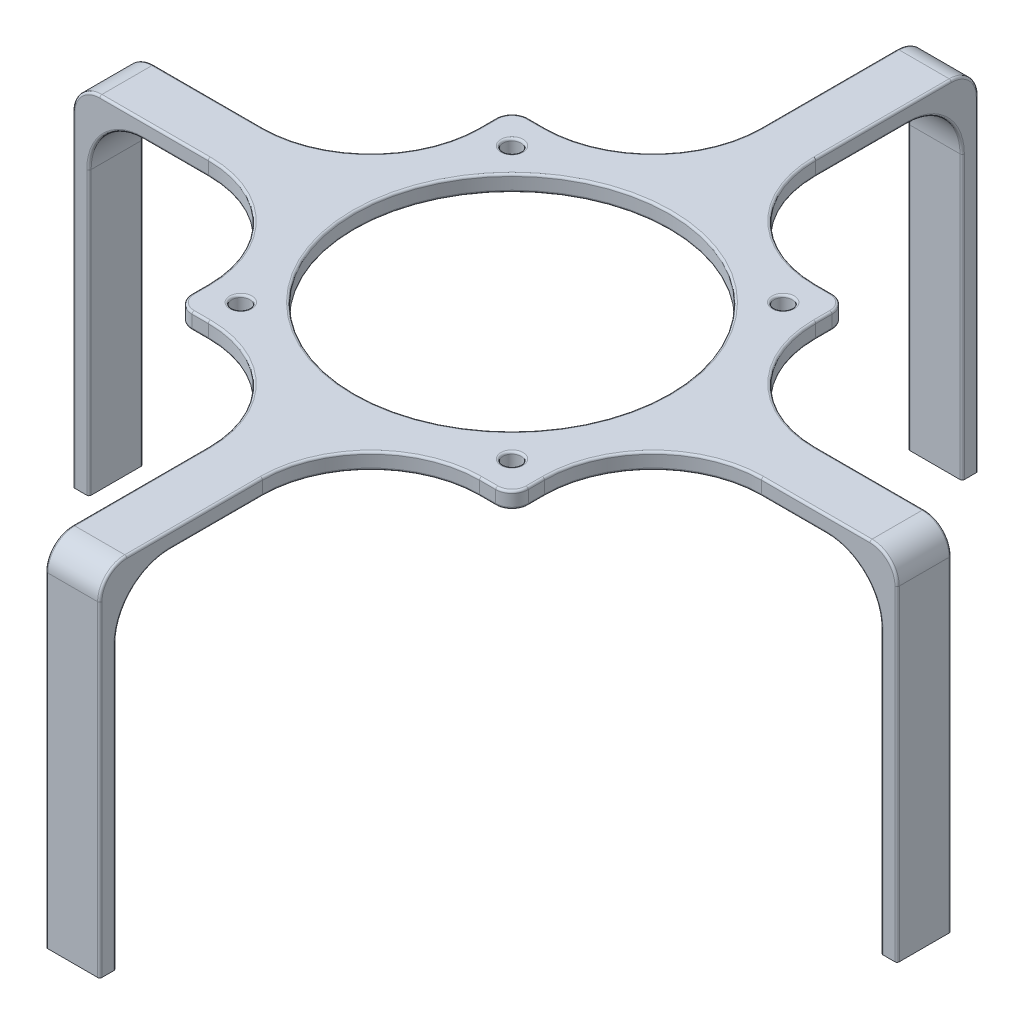
from build123d import *

# Parameters (mm, degrees)
SKETCH1_W           = 62
SKETCH1_H           = 62
BOSS_EXTRUDE1_DEPTH = 3
SKETCH2_R           = 1.65
SKETCH2_R_2         = 29
CUT_EXTRUDE1_DEPTH  = 10
SKETCH3_W           = 10
SKETCH3_H           = 50
SKETCH3_W_2         = 45
SKETCH3_H_2         = 10
BOSS_EXTRUDE2_DEPTH = 3
SKETCH4_W           = 10
SKETCH4_H           = 3
SKETCH4_W_2         = 3
SKETCH4_H_2         = 10
BOSS_EXTRUDE3_DEPTH = 62
FILLET2_R           = 10
FILLET3_R           = 5
FILLET1_R           = 20
FILLET4_R           = 3
FILLET5_R           = 0.4
FILLET7_R           = 0.4


with BuildPart() as part:
    # Sketch1 → Boss-Extrude1 (new body)
    with BuildSketch(Plane(origin=(0, 0, 0), x_dir=(1, 0, 0), z_dir=(0, 1, 0))):
        with Locations((31, -31)):
            Rectangle(SKETCH1_W, SKETCH1_H)
    extrude(amount=BOSS_EXTRUDE1_DEPTH)

    # Sketch2 → Cut-Extrude1 (cut)
    with BuildSketch(Plane(origin=(0, 0, 0), x_dir=(-1, 0, 0), z_dir=(0, -1, 0))):
        with Locations(Location((-56, -56, 0), (0, 0, 90))):
            Circle(SKETCH2_R)
        with Locations(Location((-6, -56, 0), (0, 0, 90))):
            Circle(SKETCH2_R)
        with Locations(Location((-6, -6, 0), (0, 0, 90))):
            Circle(SKETCH2_R)
        with Locations(Location((-56, -6, 0), (0, 0, 90))):
            Circle(SKETCH2_R)
        with Locations(Location((-31, -31, 0), (0, 0, 90))):
            Circle(SKETCH2_R_2)
    extrude(amount=-CUT_EXTRUDE1_DEPTH, mode=Mode.SUBTRACT)

    # Sketch3 → Boss-Extrude2 (add)
    with BuildSketch(Plane(origin=(0, 3, 0), x_dir=(1, 0, 0), z_dir=(0, 1, 0))):
        with Locations((31, 25)):
            Rectangle(SKETCH3_W, SKETCH3_H)
        with Locations((-22.5, -31)):
            Rectangle(SKETCH3_W_2, SKETCH3_H_2)
        with Locations((84.5, -31)):
            Rectangle(SKETCH3_W_2, SKETCH3_H_2)
        with Locations((31, -87)):
            Rectangle(SKETCH3_W, SKETCH3_H)
    extrude(amount=-BOSS_EXTRUDE2_DEPTH)

    # Sketch4 → Boss-Extrude3 (add)
    with BuildSketch(Plane(origin=(0, 0, 0), x_dir=(-1, 0, 0), z_dir=(0, -1, 0))):
        with Locations((-31, 48.5)):
            Rectangle(SKETCH4_W, SKETCH4_H)
        with Locations((-105.5, -31)):
            Rectangle(SKETCH4_W_2, SKETCH4_H_2)
        with Locations((-31, -110.5)):
            Rectangle(SKETCH4_W, SKETCH4_H)
        with Locations((43.5, -31)):
            Rectangle(SKETCH4_W_2, SKETCH4_H_2)
    extrude(amount=BOSS_EXTRUDE3_DEPTH)

    # Fillet2
    fillet2_edges = [part.edges().sort_by_distance(p)[0] for p in [
        (104, 0, 31),
        (31, 0, 109),
        (-42, 0, 31),
        (31, 0, -47),
    ]]
    fillet(fillet2_edges, radius=FILLET2_R)

    # Fillet3
    fillet3_edges = [part.edges().sort_by_distance(p)[0] for p in [
        (31, 3, -50),
        (-45, 3, 31),
        (107, 3, 31),
        (31, 3, 112),
    ]]
    fillet(fillet3_edges, radius=FILLET3_R)

    # Fillet1
    fillet1_edges = [part.edges().sort_by_distance(p)[0] for p in [
        (26, 1.5, 0),
        (36, 1.5, 0),
        (0, 1.5, 26),
        (0, 1.5, 36),
        (62, 1.5, 36),
        (62, 1.5, 26),
        (26, 1.5, 62),
        (36, 1.5, 62),
    ]]
    fillet(fillet1_edges, radius=FILLET1_R)

    # Fillet4
    fillet4_edges = [part.edges().sort_by_distance(p)[0] for p in [
        (0, 1.5, 0),
        (62, 1.5, 0),
        (62, 1.5, 62),
        (0, 1.5, 62),
    ]]
    fillet(fillet4_edges, radius=FILLET4_R)

    # Fillet5
    fillet5_edges = [part.edges().sort_by_distance(p)[0] for p in [
        (-30, 3, 36),
        (36, 3, 94.5),
        (92, 3, 26),
        (26, 3, -32.5),
        (105.535533906, 1.535533906, 26),
        (105.535533906, 1.535533906, 36),
        (36, 1.535533906, 110.535533906),
        (26, 1.535533906, 110.535533906),
        (-43.535533906, 1.535533906, 36),
        (-43.535533906, 1.535533906, 26),
        (26, 1.535533906, -48.535533906),
        (36, 1.535533906, -48.535533906),
        (6, 3, 57.65),
        (36, 3, -32.5),
        (4.5, 3, 0),
        (-30, 3, 26),
        (0, 3, 57.5),
        (26, 3, 94.5),
        (57.5, 3, 62),
        (62, 3, 4.5),
        (92, 3, 36),
        (41.857864376, 3, -5.857864376),
        (20.142135624, 3, -5.857864376),
        (-5.857864376, 3, 20.142135624),
        (-5.857864376, 3, 41.857864376),
        (6, 3, 7.65),
        (20.142135624, 3, 67.857864376),
        (41.857864376, 3, 67.857864376),
        (67.857864376, 3, 20.142135624),
        (67.857864376, 3, 41.857864376),
        (31, 3, 60),
        (57.5, 3, 0),
        (62, 3, 57.5),
        (56, 3, 7.65),
        (0, 3, 4.5),
        (4.5, 3, 62),
        (0.878679656, 3, 0.878679656),
        (0.878679656, 3, 61.121320344),
        (61.121320344, 3, 61.121320344),
        (61.121320344, 3, 0.878679656),
        (56, 3, 57.65),
        (26, -32, -50),
        (36, -32, -50),
        (-45, -32, 36),
        (-45, -32, 26),
        (107, -32, 26),
        (107, -32, 36),
        (26, -32, 112),
        (36, -32, 112),
    ]]
    fillet(fillet5_edges, radius=FILLET5_R)

    # Fillet7
    fillet7_edges = [part.edges().sort_by_distance(p)[0] for p in [
        (104, -36, 36),
        (104, -36, 26),
        (36, -36, 109),
        (26, -36, 109),
        (-42, -36, 26),
        (-42, -36, 36),
        (26, 0, -28.5),
        (88, 0, 26),
        (36, 0, 90.5),
        (-26, 0, 36),
        (36, -2.928932188, 106.071067812),
        (26, -2.928932188, 106.071067812),
        (-39.071067812, -2.928932188, 36),
        (-39.071067812, -2.928932188, 26),
        (26, -2.928932188, -44.071067812),
        (36, -2.928932188, -44.071067812),
        (101.071067812, -2.928932188, 26),
        (101.071067812, -2.928932188, 36),
        (6, 0, 57.65),
        (36, 0, -28.5),
        (4.5, 0, 0),
        (-26, 0, 26),
        (0, 0, 57.5),
        (26, 0, 90.5),
        (57.5, 0, 62),
        (62, 0, 4.5),
        (88, 0, 36),
        (41.857864376, 0, -5.857864376),
        (20.142135624, 0, -5.857864376),
        (-5.857864376, 0, 20.142135624),
        (-5.857864376, 0, 41.857864376),
        (6, 0, 7.65),
        (20.142135624, 0, 67.857864376),
        (41.857864376, 0, 67.857864376),
        (67.857864376, 0, 20.142135624),
        (67.857864376, 0, 41.857864376),
        (31, 0, 60),
        (57.5, 0, 0),
        (4.5, 0, 62),
        (0, 0, 4.5),
        (62, 0, 57.5),
        (0.878679656, 0, 0.878679656),
        (0.878679656, 0, 61.121320344),
        (61.121320344, 0, 61.121320344),
        (61.121320344, 0, 0.878679656),
        (56, 0, 7.65),
        (56, 0, 57.65),
        (36, -36, -47),
        (26, -36, -47),
    ]]
    fillet(fillet7_edges, radius=FILLET7_R)


solid = part.part
